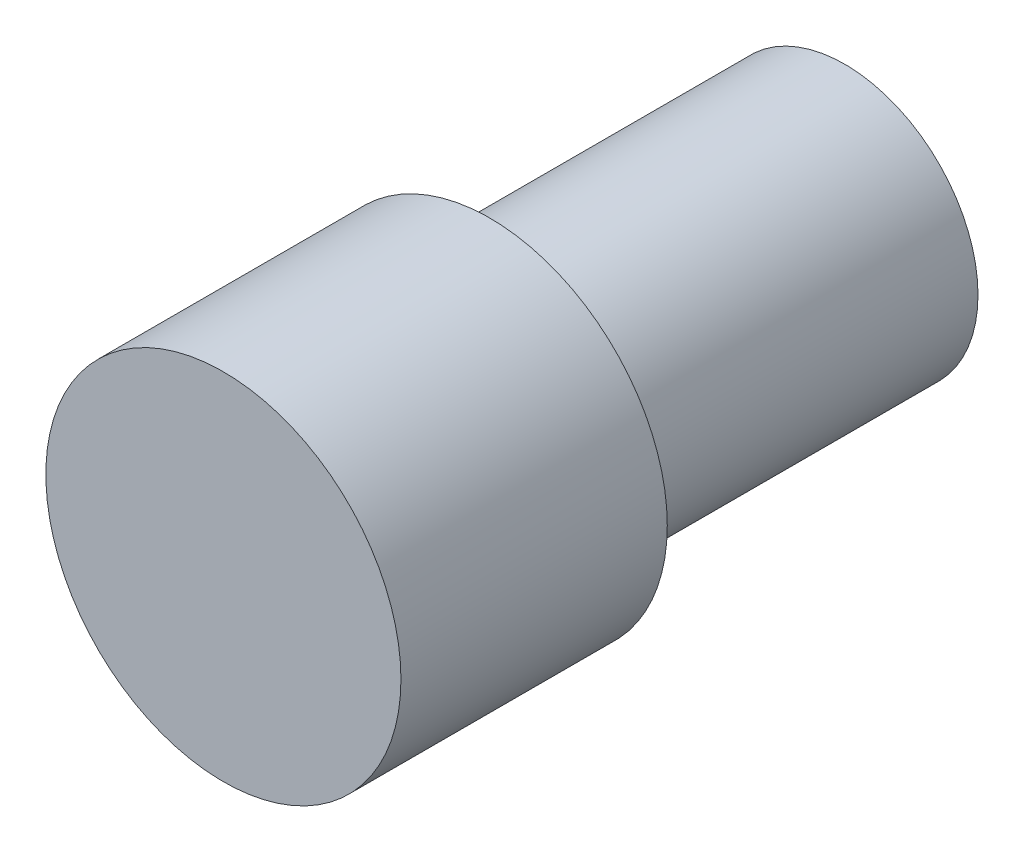
from build123d import *

# Parameters (mm, degrees)
SKETCH1_R           = 2
BOSS_EXTRUDE1_DEPTH = 3
SKETCH1_3_R         = 1.5
BOSS_EXTRUDE2_DEPTH = 4


with BuildPart() as part:
    # Sketch1 → Boss-Extrude1 (new body)
    with BuildSketch(Plane.XY):
        Circle(SKETCH1_R)
    extrude(amount=BOSS_EXTRUDE1_DEPTH)

    # Sketch1<3> → Boss-Extrude2 (add)
    with BuildSketch(Plane.XY):
        Circle(SKETCH1_3_R)
    extrude(amount=-BOSS_EXTRUDE2_DEPTH)


solid = part.part
